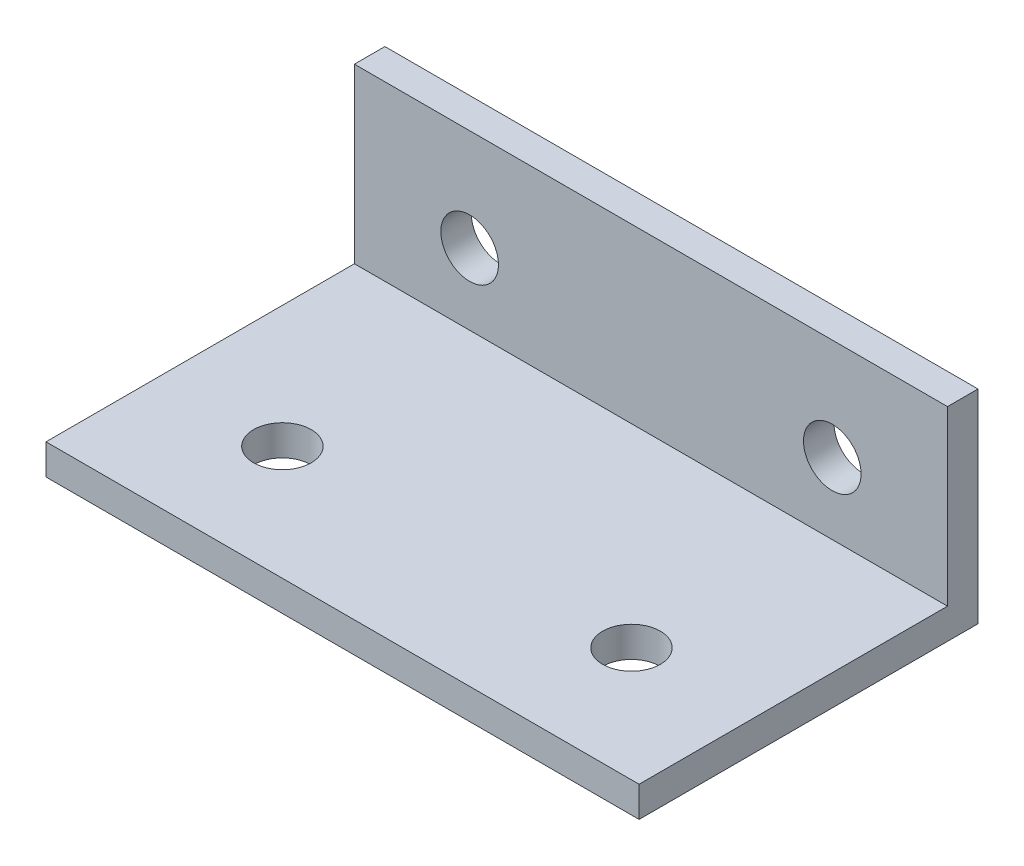
from build123d import *

# Parameters (mm, degrees)
ESQUISSE1_W        = 35
ESQUISSE1_H        = 20
BOSS_EXTRU_1_DEPTH = 1.8
ESQUISSE2_W        = 35
ESQUISSE2_H        = 1.8
BOSS_EXTRU_2_DEPTH = 10.2
D_GAGEMENT_M31_D   = 3.4
D_GAGEMENT_M32_D   = 3.4


with BuildPart() as part:
    # Esquisse1 → Boss.-Extru.1 (new body)
    with BuildSketch(Plane(origin=(0, 0, 0), x_dir=(1, 0, 0), z_dir=(0, 1, 0))):
        Rectangle(ESQUISSE1_W, ESQUISSE1_H)
    extrude(amount=BOSS_EXTRU_1_DEPTH)

    # Esquisse2 → Boss.-Extru.2 (add)
    with BuildSketch(Plane(origin=(0, 1.8, 0), x_dir=(1, 0, 0), z_dir=(0, 1, 0))):
        with Locations((0, 9.1)):
            Rectangle(ESQUISSE2_W, ESQUISSE2_H)
    extrude(amount=BOSS_EXTRU_2_DEPTH)

    # Dégagement M31 (through all)
    with Locations(Plane.XY.offset(-8.2)):
        with Locations((-10.7, 6), (10.7, 6)):
            Hole(D_GAGEMENT_M31_D / 2)

    # Dégagement M32 (through all)
    with Locations(Plane(origin=(0, 1.8, 0), x_dir=(1, 0, 0), z_dir=(0, 1, 0))):
        with Locations((-10.3, -3.25), (10.3, -3.25)):
            Hole(D_GAGEMENT_M32_D / 2)


solid = part.part
